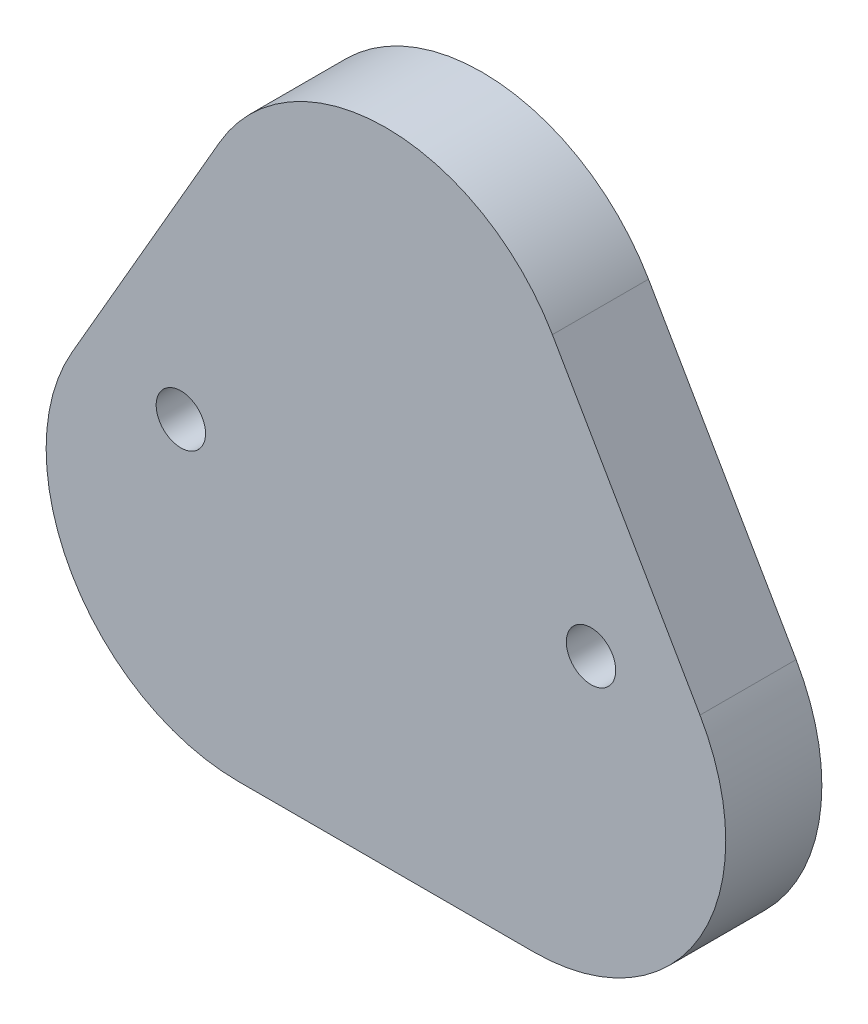
from build123d import *

# Parameters (mm, degrees)
BOSS_EXTRUDE1_DEPTH       = 6.35
F_4_CLEARANCE_HOLE1_D     = 3.2639
F_4_CLEARANCE_HOLE1_DEPTH = 9.652
F_4_CLEARANCE_HOLE1_TIP   = 0.980574487
FILLET1_R                 = 12.7


with BuildPart() as part:
    # Sketch1 → Boss-Extrude1 (new body)
    with BuildSketch(Plane.XY):
        Polygon((0.838479943, 39.56529588), (-30.911520057, -15.42731726), (32.588479943, -15.42731726), align=None)
    extrude(amount=BOSS_EXTRUDE1_DEPTH)

    # #4 Clearance Hole1
    with Locations(Plane(origin=(-12.712258743, 3.394727996, 6.35), x_dir=(1, 0, 0), z_dir=(0, 0, 1))):
        with Locations((0, 0), (27.101477372, 0)):
            Hole(F_4_CLEARANCE_HOLE1_D / 2, depth=F_4_CLEARANCE_HOLE1_DEPTH)
            with Locations((0, 0, -(F_4_CLEARANCE_HOLE1_DEPTH + F_4_CLEARANCE_HOLE1_TIP / 2))):  # 118° drill point
                Cone(0, F_4_CLEARANCE_HOLE1_D / 2, F_4_CLEARANCE_HOLE1_TIP, mode=Mode.SUBTRACT)

    # Fillet1
    fillet1_edges = [part.edges().sort_by_distance(p)[0] for p in [
        (32.588479943, -15.42731726, 3.175),
        (-30.911520057, -15.42731726, 3.175),
        (0.838479943, 39.56529588, 3.175),
    ]]
    fillet(fillet1_edges, radius=FILLET1_R)


solid = part.part
